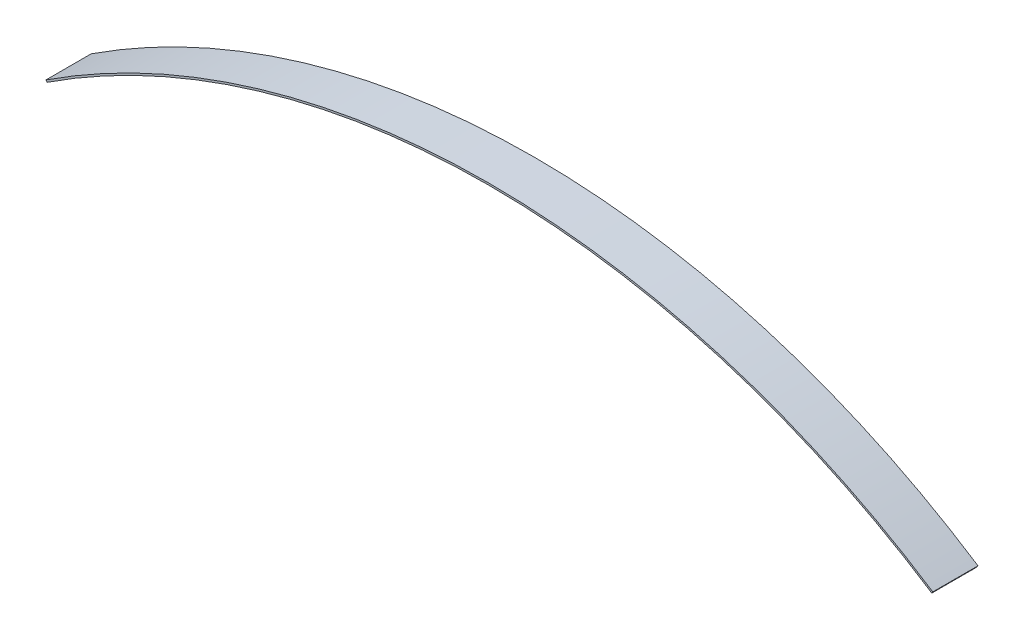
from build123d import *

# Parameters (mm, degrees)
EXTRUDE_1_DEPTH = 12


with BuildPart() as part:
    # Эскиз1 → Вытянуть-Тонкостенный1 (new body)
    with BuildSketch(Plane.XY):
        with BuildLine():
            ThreePointArc((-99.309826828, -35), (18.190173172, 0), (135.690173172, -35))
            Line((135.690173172, -35), (135.963769846, -34.581496881))
            ThreePointArc((135.963769846, -34.581496881), (18.190173172, 0.5), (-99.583423502, -34.581496881))
            Line((-99.583423502, -34.581496881), (-99.309826828, -35))
        make_face()
    extrude(amount=EXTRUDE_1_DEPTH)


solid = part.part
